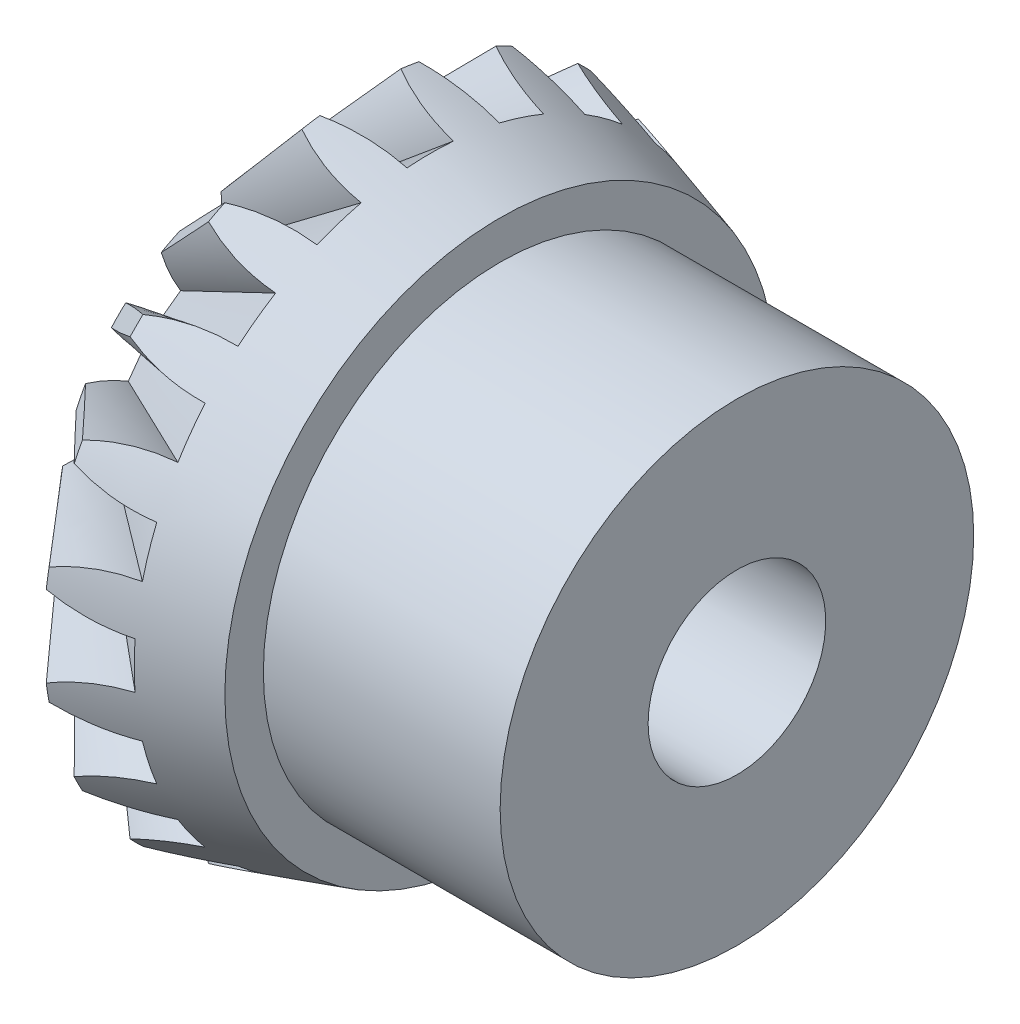
from build123d import *

# Parameters (mm, degrees)
CIRPATTERN1_COUNT = 20


with BuildPart() as part:
    # Sketch1 → Revolve1 (revolve)
    with BuildSketch(Plane.XY, mode=Mode.PRIVATE) as revolve1_sk:
        Polygon((0, 1.5), (8, 1.5), (8, 4), (4, 4), (4, 4.65), (1.639708456, 5.35), (0, 3.462844421), align=None)
    revolve(revolve1_sk.sketch.rotate(Axis((0, 0, 0), (1, 0, 0)), 90), axis=Axis((0, 0, 0), (1, 0, 0)))

    # Sketch6 for Cut-Loft1 → Cut-Loft1 section 0
    with BuildSketch(Plane(origin=(2.819854228, 0, 0), x_dir=(0, 0, -1), z_dir=(1, 0, 0))):
        with BuildLine():
            Line((-2.607480562, 8.025), (2.607480562, 8.025))
            # circular arc as an exact rational Bezier (weights 1, cos(half-angle), 1)
            Bezier((2.607480562, 8.025), (0.565515721, 7.185558531), (0.392295479, 4.984586669), weights=[1, 0.851943225, 1])
            Bezier((0.392295479, 4.984586669), (0, 5.015460992), (-0.392295479, 4.984586669), weights=[1, 0.996917334, 1])
            Bezier((-0.392295479, 4.984586669), (-0.565515721, 7.185558531), (-2.607480562, 8.025), weights=[1, 0.851943225, 1])
        make_face()
    # Sketch5 for Cut-Loft1 → Cut-Loft1 section 1
    with BuildSketch(Plane.ZY):
        with BuildLine():
            Line((-0.209878081, 2.666753868), (0.209878081, 2.666753868))
            Bezier((0.209878081, 2.666753868), (0.33323155, 4.2341083), (1.65324092, 5.088152362), weights=[1, 0.896497279, 1])
            Bezier((1.65324092, 5.088152362), (0, 5.6253229), (-1.65324092, 5.088152362), weights=[1, 0.951056516, 1])
            Bezier((-1.65324092, 5.088152362), (-0.33323155, 4.2341083), (-0.209878081, 2.666753868), weights=[1, 0.896497279, 1])
        make_face()
    cut_loft1 = loft(mode=Mode.SUBTRACT)

    # CirPattern1: Cut-Loft1 ×20 about axis
    cirpattern1_axis = Axis((0, 0, 0), (-1, 0, 0))
    for i in range(1, CIRPATTERN1_COUNT):
        add(cut_loft1.rotate(cirpattern1_axis, i * 360 / CIRPATTERN1_COUNT), mode=Mode.SUBTRACT)


solid = part.part
